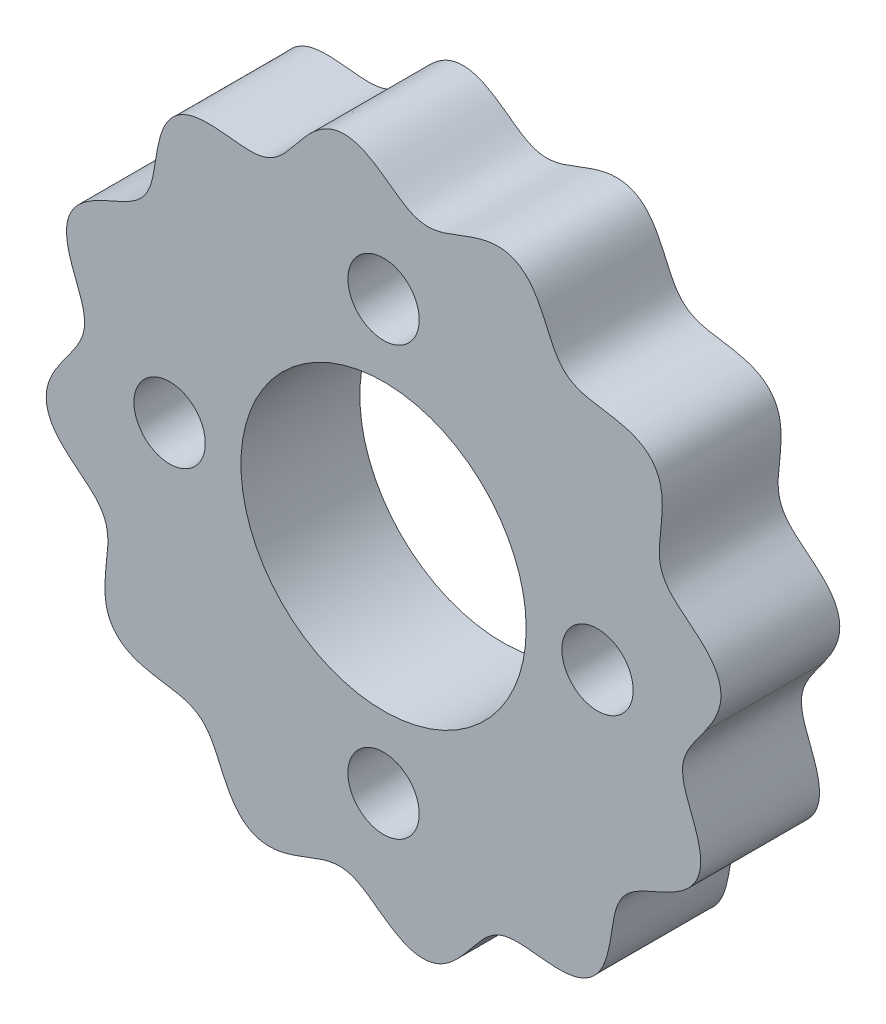
from build123d import *

# Parameters (mm, degrees)
EXTRUDE_1_DEPTH          = 5
EXTRUDE_1_DEPTH_BACK     = 5
SKETCH_1_R               = 12
CUT_EXTRUDE_1_DEPTH      = 10
CUT_EXTRUDE_1_DEPTH_BACK = 10
SKETCH_2_R               = 3


with BuildPart() as part:
    # 草图1 → 凸台-拉伸1 (new, two sides: drawn at the far end of the back side and taken through both)
    with BuildSketch(Plane.XY.offset(-EXTRUDE_1_DEPTH_BACK)):
        with BuildLine():
            add(Edge.make_bspline(
                [(27, 1e-09), (27.038329618, 0.053901025), (27.115014782, 0.162907478), (27.276476053, 0.396041545), (27.447701282, 0.656953046), (27.612122564, 0.923715907), (27.77013463, 1.200483311), (27.951855971, 1.552617031), (28.156734998, 2.023540025), (28.342276646, 2.627812976), (28.420849834, 3.358705174), (28.319548283, 4.107654001), (28.072581926, 4.750989723), (27.753990708, 5.285309302), (27.401982213, 5.739513757), (27.044235493, 6.127714964), (26.626247568, 6.526405154), (26.150499336, 6.935434499), (25.623024953, 7.3601277), (25.055495548, 7.814403897), (24.506772541, 8.286529313), (24.003302601, 8.803007081), (23.585873423, 9.392941702), (23.31187603, 10.062482961), (23.194598855, 10.780149453), (23.189869052, 11.510641827), (23.247468165, 12.241995777), (23.329842582, 12.97569032), (23.415594479, 13.785986393), (23.470538448, 14.679018115), (23.426737842, 15.734217744), (23.156884114, 16.767833322), (22.612560688, 17.599369689), (21.84335094, 18.230373336), (21.015845602, 18.643793933), (20.134208597, 18.901118206), (19.238533525, 19.073565794), (18.433162473, 19.196807948), (17.724607482, 19.306511945), (17.022949353, 19.443080766), (16.338569744, 19.642903655), (15.690252149, 19.951618164), (15.125636448, 20.402094584), (14.670490855, 20.972264674), (14.303151, 21.610758753), (13.987307124, 22.280495924), (13.689414504, 22.96442087), (13.357231745, 23.707422844), (12.957856931, 24.497578402), (12.388540605, 25.379111046), (11.639197645, 26.122667498), (10.756310084, 26.556041748), (9.790558951, 26.707272115), (8.902220986, 26.654715978), (8.035742526, 26.449390283), (7.191940868, 26.16259901), (6.437470652, 25.870092195), (5.760265662, 25.605997025), (5.077046925, 25.366696387), (4.378020568, 25.189003235), (3.658412294, 25.122419192), (2.941571057, 25.219929274), (2.261416852, 25.477179462), (1.626425783, 25.838341717), (1.021855057, 26.253892778), (0.427643673, 26.692083201), (-0.231217095, 27.171491874), (-0.977133422, 27.665592153), (-1.912863319, 28.155258624), (-2.942927586, 28.438366773), (-3.935220887, 28.382736741), (-4.866290965, 28.032083548), (-5.638076363, 27.52215309), (-6.301744232, 26.887295269), (-6.898925754, 26.197841641), (-7.408342119, 25.561990959), (-7.857626062, 25.003216317), (-8.326727195, 24.463846974), (-8.841968697, 23.971068285), (-9.433482102, 23.563966036), (-10.105913977, 23.300232704), (-10.827268555, 23.191150104), (-11.563890575, 23.192271496), (-12.301821917, 23.253611262), (-13.043064606, 23.337591158), (-13.852614567, 23.421413438), (-14.736596765, 23.470622482), (-15.784684584, 23.418346403), (-16.803294852, 23.14117459), (-17.620051727, 22.593258657), (-18.233896656, 21.832508827), (-18.632550642, 21.03690751), (-18.887972702, 20.183852311), (-19.061504835, 19.309702993), (-19.185421882, 18.510059229), (-19.295310774, 17.791534889), (-19.42968052, 17.080199839), (-19.625305718, 16.385978603), (-19.92744815, 15.729487649), (-20.370312213, 15.15743979), (-20.933179139, 14.697034361), (-21.563441944, 14.327696552), (-22.225620236, 14.011899447), (-22.902184704, 13.716390883), (-23.646836794, 13.385507739), (-24.447630912, 12.986570991), (-25.339663658, 12.421045424), (-26.094750311, 11.675439171), (-26.538761078, 10.802517772), (-26.703100421, 9.85694291), (-26.666365821, 8.988428209), (-26.477281436, 8.135521353), (-26.202732395, 7.301639297), (-25.914793282, 6.550792045), (-25.648201985, 5.870763507), (-25.401664383, 5.187163079), (-25.211021331, 4.488624078), (-25.124411004, 3.785352657), (-25.188594434, 3.093321998), (-25.394905104, 2.451828627), (-25.696169113, 1.863735812), (-26.044343878, 1.320885268), (-26.385099144, 0.844516455), (-26.65348463, 0.479919104), (-26.881869664, 0.164896492), (-26.960720302, 0.055237075), (-27, -1e-09)],
                knots=[0.08250356, 0.08250356, 0.08250356, 0.08250356, 0.08250356, 0.085297074, 0.088090587, 0.0908841, 0.093677614, 0.096471127, 0.099264641, 0.104851668, 0.111756318, 0.118660968, 0.124939935, 0.131218902, 0.135865943, 0.140512985, 0.145160026, 0.149807067, 0.15621266, 0.162618252, 0.169023845, 0.175429437, 0.181707775, 0.187986113, 0.194329471, 0.20067283, 0.207174601, 0.213676373, 0.220178144, 0.226679916, 0.235913781, 0.245147647, 0.257333433, 0.263760898, 0.270188364, 0.279939855, 0.289691347, 0.296009802, 0.302328257, 0.308646712, 0.314965167, 0.32118272, 0.327400274, 0.33378526, 0.340170246, 0.346739484, 0.353308723, 0.359877961, 0.3664472, 0.375446228, 0.384445256, 0.396798342, 0.403077309, 0.409356276, 0.418650358, 0.427944441, 0.434350033, 0.440755626, 0.447161218, 0.453566811, 0.459845149, 0.466123486, 0.472466845, 0.478810203, 0.485311975, 0.491813746, 0.498315518, 0.504817289, 0.514051155, 0.52328502, 0.535470807, 0.541898272, 0.548325738, 0.558077229, 0.567828721, 0.574147176, 0.580465631, 0.586784085, 0.59310254, 0.599320094, 0.605537647, 0.611922633, 0.61830762, 0.624876858, 0.631446097, 0.638015335, 0.644584573, 0.653583602, 0.66258263, 0.674935716, 0.681214682, 0.687493649, 0.696787732, 0.706081814, 0.712487407, 0.718893, 0.725298592, 0.731704185, 0.737982522, 0.74426086, 0.750604218, 0.756947577, 0.763449348, 0.76995112, 0.776452891, 0.782954663, 0.792188529, 0.801422394, 0.81360818, 0.819792934, 0.825977687, 0.835004875, 0.844032064, 0.850467934, 0.856903804, 0.863339674, 0.869775544, 0.876072127, 0.88236871, 0.888191169, 0.894013628, 0.899739141, 0.905464655, 0.911190168, 0.914052924, 0.916915681, 0.916915681, 0.916915681, 0.916915681, 0.916915681], degree=4))
            add(Edge.make_bspline(
                [(-27, -1e-09), (-27.038329618, -0.053901025), (-27.115014782, -0.162907478), (-27.276476053, -0.396041545), (-27.447701282, -0.656953046), (-27.612122564, -0.923715907), (-27.77013463, -1.200483311), (-27.951855971, -1.552617031), (-28.156734998, -2.023540025), (-28.342276646, -2.627812976), (-28.420849834, -3.358705174), (-28.319548283, -4.107654001), (-28.072581926, -4.750989723), (-27.753990708, -5.285309302), (-27.401982213, -5.739513757), (-27.044235493, -6.127714964), (-26.626247568, -6.526405154), (-26.150499336, -6.935434499), (-25.623024953, -7.3601277), (-25.055495548, -7.814403897), (-24.506772541, -8.286529313), (-24.003302601, -8.803007081), (-23.585873423, -9.392941702), (-23.31187603, -10.062482961), (-23.194598855, -10.780149453), (-23.189869052, -11.510641827), (-23.247468165, -12.241995777), (-23.329842582, -12.97569032), (-23.415594479, -13.785986393), (-23.470538448, -14.679018115), (-23.426737842, -15.734217744), (-23.156884114, -16.767833322), (-22.612560688, -17.599369689), (-21.84335094, -18.230373336), (-21.015845602, -18.643793933), (-20.134208597, -18.901118206), (-19.238533525, -19.073565794), (-18.433162473, -19.196807948), (-17.724607482, -19.306511945), (-17.022949353, -19.443080766), (-16.338569744, -19.642903655), (-15.690252149, -19.951618164), (-15.125636448, -20.402094584), (-14.670490855, -20.972264674), (-14.303151, -21.610758753), (-13.987307124, -22.280495924), (-13.689414504, -22.96442087), (-13.357231745, -23.707422844), (-12.957856931, -24.497578402), (-12.388540605, -25.379111046), (-11.639197645, -26.122667498), (-10.756310084, -26.556041748), (-9.790558951, -26.707272115), (-8.902220986, -26.654715978), (-8.035742526, -26.449390283), (-7.191940868, -26.16259901), (-6.437470652, -25.870092195), (-5.760265662, -25.605997025), (-5.077046925, -25.366696387), (-4.378020568, -25.189003235), (-3.658412294, -25.122419192), (-2.941571057, -25.219929274), (-2.261416852, -25.477179462), (-1.626425783, -25.838341717), (-1.021855057, -26.253892778), (-0.427643673, -26.692083201), (0.231217095, -27.171491874), (0.977133422, -27.665592153), (1.912863319, -28.155258624), (2.942927586, -28.438366773), (3.935220887, -28.382736741), (4.866290965, -28.032083548), (5.638076363, -27.52215309), (6.301744232, -26.887295269), (6.898925754, -26.197841641), (7.408342119, -25.561990959), (7.857626062, -25.003216317), (8.326727195, -24.463846974), (8.841968697, -23.971068285), (9.433482102, -23.563966036), (10.105913977, -23.300232704), (10.827268555, -23.191150104), (11.563890575, -23.192271496), (12.301821917, -23.253611262), (13.043064606, -23.337591158), (13.852614567, -23.421413438), (14.736596765, -23.470622482), (15.784684584, -23.418346403), (16.803294852, -23.14117459), (17.620051727, -22.593258657), (18.233896656, -21.832508827), (18.632550642, -21.03690751), (18.887972702, -20.183852311), (19.061504835, -19.309702993), (19.185421882, -18.510059229), (19.295310774, -17.791534889), (19.42968052, -17.080199839), (19.625305718, -16.385978603), (19.92744815, -15.729487649), (20.370312213, -15.15743979), (20.933179139, -14.697034361), (21.563441944, -14.327696552), (22.225620236, -14.011899447), (22.902184704, -13.716390883), (23.646836794, -13.385507739), (24.447630912, -12.986570991), (25.339663658, -12.421045424), (26.094750311, -11.675439171), (26.538761078, -10.802517772), (26.703100421, -9.85694291), (26.666365821, -8.988428209), (26.477281436, -8.135521353), (26.202732394, -7.301639297), (25.914793282, -6.550792045), (25.648201985, -5.870763507), (25.401664383, -5.187163079), (25.211021331, -4.488624078), (25.124411004, -3.785352657), (25.188594434, -3.093321998), (25.394905104, -2.451828627), (25.696169113, -1.863735812), (26.044343878, -1.320885268), (26.385099144, -0.844516455), (26.65348463, -0.479919104), (26.881869664, -0.164896493), (26.960720302, -0.055237076), (27, 1e-09)],
                knots=[0.08250356, 0.08250356, 0.08250356, 0.08250356, 0.08250356, 0.085297074, 0.088090587, 0.0908841, 0.093677614, 0.096471127, 0.099264641, 0.104851668, 0.111756318, 0.118660968, 0.124939935, 0.131218902, 0.135865943, 0.140512985, 0.145160026, 0.149807067, 0.15621266, 0.162618252, 0.169023845, 0.175429437, 0.181707775, 0.187986113, 0.194329471, 0.20067283, 0.207174601, 0.213676373, 0.220178144, 0.226679916, 0.235913781, 0.245147647, 0.257333433, 0.263760898, 0.270188364, 0.279939855, 0.289691347, 0.296009802, 0.302328257, 0.308646712, 0.314965167, 0.32118272, 0.327400274, 0.33378526, 0.340170246, 0.346739484, 0.353308723, 0.359877961, 0.3664472, 0.375446228, 0.384445256, 0.396798342, 0.403077309, 0.409356276, 0.418650358, 0.427944441, 0.434350033, 0.440755626, 0.447161218, 0.453566811, 0.459845149, 0.466123486, 0.472466845, 0.478810203, 0.485311975, 0.491813746, 0.498315518, 0.504817289, 0.514051155, 0.52328502, 0.535470807, 0.541898272, 0.548325738, 0.558077229, 0.567828721, 0.574147176, 0.580465631, 0.586784085, 0.59310254, 0.599320094, 0.605537647, 0.611922633, 0.61830762, 0.624876858, 0.631446097, 0.638015335, 0.644584573, 0.653583602, 0.66258263, 0.674935716, 0.681214682, 0.687493649, 0.696787732, 0.706081814, 0.712487407, 0.718893, 0.725298592, 0.731704185, 0.737982522, 0.74426086, 0.750604218, 0.756947577, 0.763449348, 0.76995112, 0.776452891, 0.782954663, 0.792188529, 0.801422394, 0.81360818, 0.819792934, 0.825977687, 0.835004875, 0.844032064, 0.850467934, 0.856903804, 0.863339674, 0.869775544, 0.876072127, 0.88236871, 0.888191169, 0.894013628, 0.899739141, 0.905464655, 0.911190168, 0.914052924, 0.916915681, 0.916915681, 0.916915681, 0.916915681, 0.916915681], degree=4))
        make_face()
        Circle(SKETCH_1_R, mode=Mode.SUBTRACT)
    extrude(amount=EXTRUDE_1_DEPTH + EXTRUDE_1_DEPTH_BACK)

    # 草图2 → 切除-拉伸1 (cut, two sides: drawn at the far end of the back side and taken through both)
    with BuildSketch(Plane.XY.offset(-CUT_EXTRUDE_1_DEPTH_BACK)):
        with Locations((18, 0)):
            Circle(SKETCH_2_R)
        with Locations((0, -18)):
            Circle(SKETCH_2_R)
        with Locations((-18, 0)):
            Circle(SKETCH_2_R)
        with Locations((0, 18)):
            Circle(SKETCH_2_R)
    extrude(amount=CUT_EXTRUDE_1_DEPTH + CUT_EXTRUDE_1_DEPTH_BACK, mode=Mode.SUBTRACT)


solid = part.part
